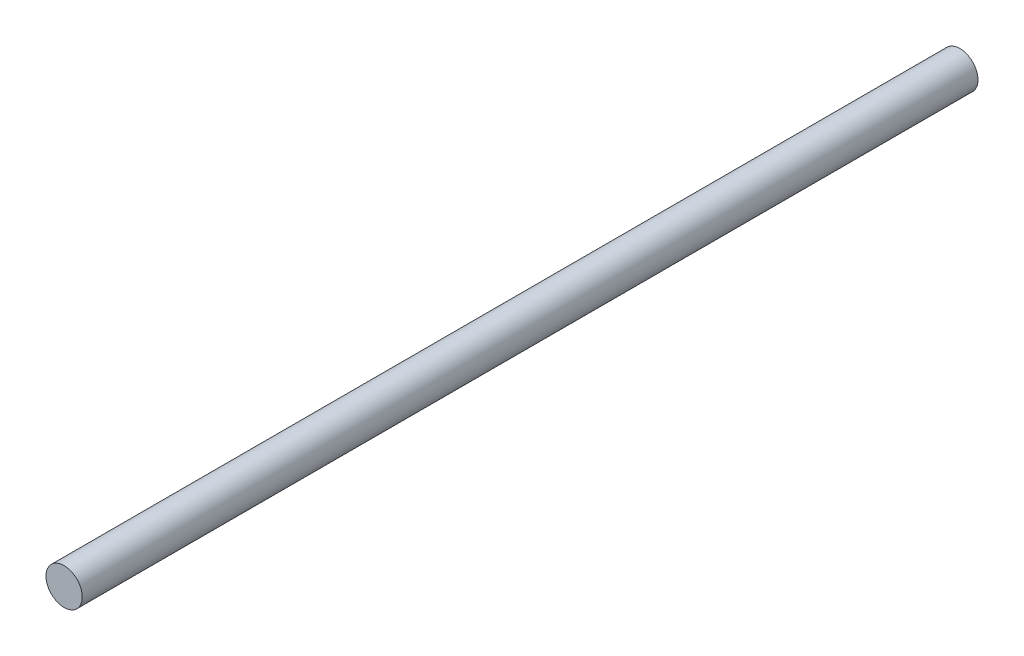
from build123d import *

# Parameters (mm, degrees)
CROQUIS1_R              = 4.05
SALIENTE_EXTRUIR1_DEPTH = 200


with BuildPart() as part:
    # Croquis1 → Saliente-Extruir1 (new body)
    with BuildSketch(Plane.XY):
        Circle(CROQUIS1_R)
    extrude(amount=SALIENTE_EXTRUIR1_DEPTH)


solid = part.part
